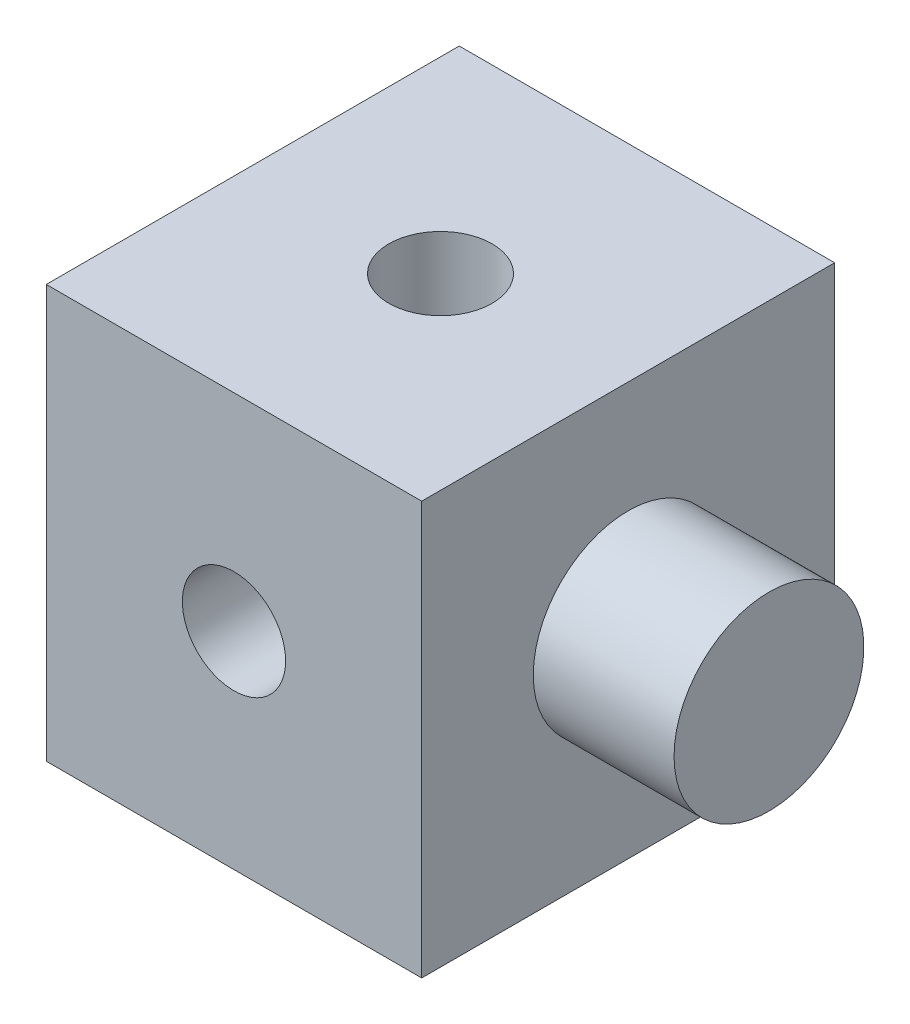
from build123d import *

# Parameters (mm, degrees)
BLOCK_SKETCH_W          = 40
BLOCK_SKETCH_H          = 44
BLOCK_DEPTH             = 22
NECK_SKETCH_W           = 15
NECK_SKETCH_H           = 10.1125
REGULATOR_PORT_SKETCH_W = 15
REGULATOR_PORT_SKETCH_H = 7.2
SIDE_PORT_Y_SKETCH_W    = 5.5
SIDE_PORT_Y_SKETCH_H    = 15
SIDE_PORT_Y_SKETCH_2_W  = 5.5
SIDE_PORT_Y_SKETCH_2_H  = 15
SIDE_PORT_Z_SKETCH_R    = 5.5
SIDE_PORT_Z_DEPTH       = 23
SIDE_START              = -23
SIDE_PORT_Z_SKETCH_2_R  = 5.5
SIDE_PORT_Z_2_DEPTH     = 23


with BuildPart() as part:
    # Block Sketch → Block (new, symmetric)
    with BuildSketch(Plane.XY):
        with Locations((-20, 0)):
            Rectangle(BLOCK_SKETCH_W, BLOCK_SKETCH_H)
    extrude(amount=BLOCK_DEPTH, both=True)

    # Neck Sketch → Neck (revolve)
    with BuildSketch(Plane.XY):
        with Locations((7.5, 5.05625)):
            Rectangle(NECK_SKETCH_W, NECK_SKETCH_H)
    revolve(axis=Axis((-1000, 0, 0), (1, 0, 0)))

    # Regulator Port Sketch → Regulator Port (revolve, cut)
    with BuildSketch(Plane.XY):
        with Locations((-33.5, 3.6)):
            Rectangle(REGULATOR_PORT_SKETCH_W, REGULATOR_PORT_SKETCH_H)
    revolve(axis=Axis((-1000, 0, 0), (1, 0, 0)), mode=Mode.SUBTRACT)

    # Side Port _Y Sketch → Side Port _Y (revolve, cut)
    with BuildSketch(Plane.XY):
        with Locations((-17.25, 15.5)):
            Rectangle(SIDE_PORT_Y_SKETCH_W, SIDE_PORT_Y_SKETCH_H)
    revolve(axis=Axis((-20, -40, 0), (0, 1, 0)), mode=Mode.SUBTRACT)

    # Side Port -Y Sketch 2 → Side Port -Y 2 (revolve, cut)
    with BuildSketch(Plane.XY):
        with Locations((-17.25, -15.5)):
            Rectangle(SIDE_PORT_Y_SKETCH_2_W, SIDE_PORT_Y_SKETCH_2_H)
    revolve(axis=Axis((-20, -40, 0), (0, 1, 0)), mode=Mode.SUBTRACT)

    # Side Port _Z Sketch → Side Port _Z (cut)
    with BuildSketch(Plane.XY):
        with Locations((-20, 0)):
            Circle(SIDE_PORT_Z_SKETCH_R)
    extrude(amount=SIDE_PORT_Z_DEPTH, mode=Mode.SUBTRACT)

    # Side Port -Z Sketch 2 → Side Port -Z 2 (cut)
    with BuildSketch(Plane.XY.offset(SIDE_START)):
        with Locations((-20, 0)):
            Circle(SIDE_PORT_Z_SKETCH_2_R)
    extrude(amount=SIDE_PORT_Z_2_DEPTH, mode=Mode.SUBTRACT)


solid = part.part
